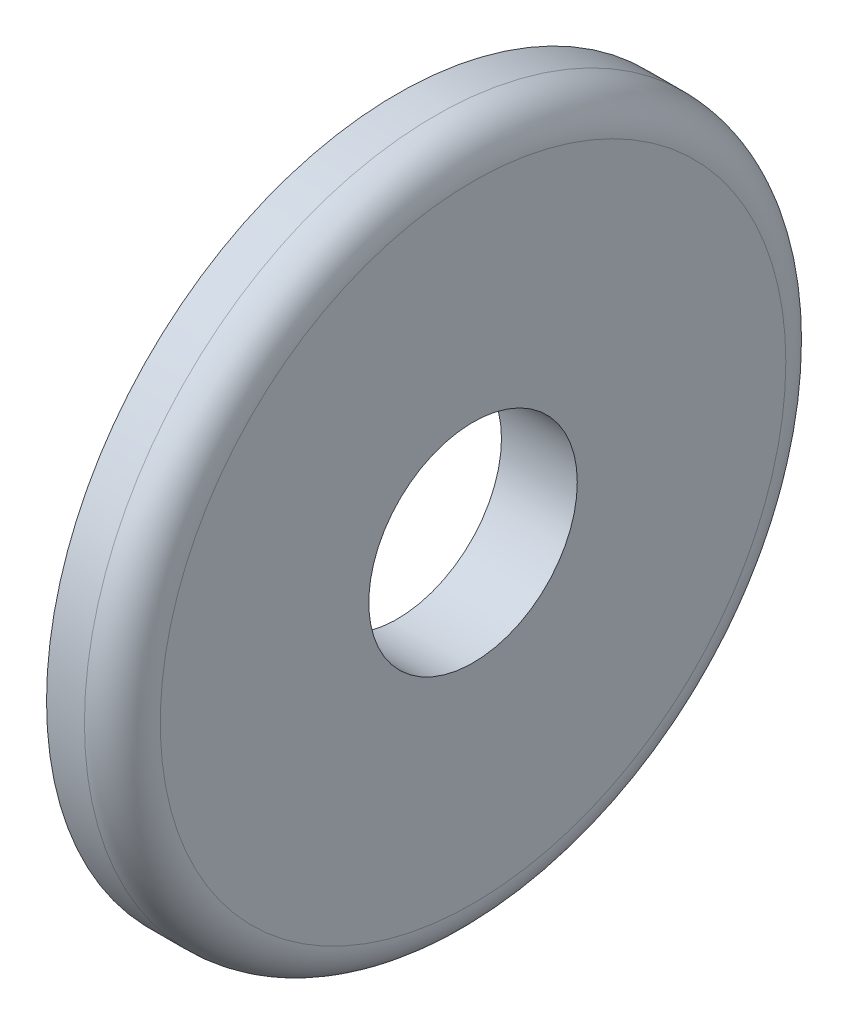
from build123d import *

# Parameters (mm, degrees)
SZKIC1_R                    = 18.5
SZKIC1_R_2                  = 5.5
DODANIE_WYCI_GNI_CIE1_DEPTH = 4
ZAOKR_GLENIE1_R             = 2


with BuildPart() as part:
    # Szkic1 → Dodanie-wyciągnięcie1 (new body)
    with BuildSketch(Plane(origin=(0, 0, 0), x_dir=(0, 0, -1), z_dir=(1, 0, 0))):
        Circle(SZKIC1_R)
        Circle(SZKIC1_R_2, mode=Mode.SUBTRACT)
    extrude(amount=DODANIE_WYCI_GNI_CIE1_DEPTH)

    # Zaokrąglenie1
    zaokr_glenie1_edges = [part.edges().sort_by_distance(p)[0] for p in [
        (4, 0, 18.5),
    ]]
    fillet(zaokr_glenie1_edges, radius=ZAOKR_GLENIE1_R)


solid = part.part
